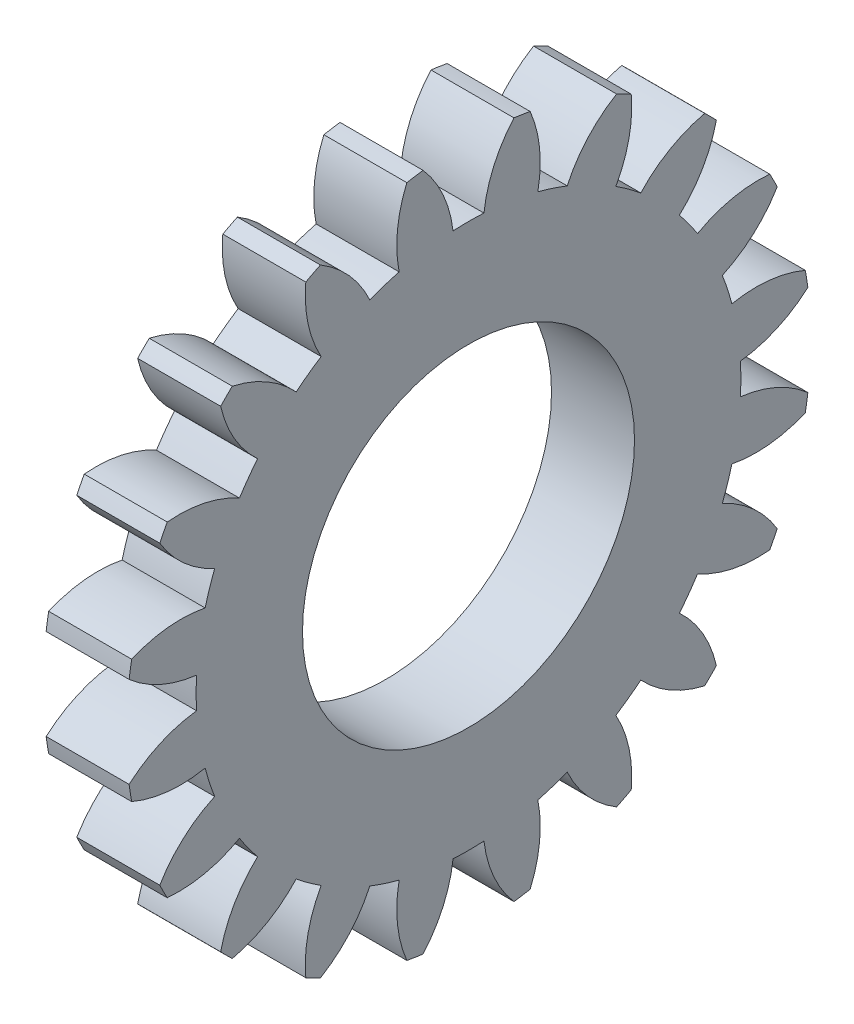
from build123d import *

# Parameters (mm, degrees)
BASPROSKE_W     = 4
BASPROSKE_H     = 16.5
TOOTHCUT_DEPTH  = 24.674881203
TEETHCUTS_COUNT = 20
TEETHCUTS_ANGLE = 342
BORSKE_R        = 8
BORE_DEPTH      = 50.0000508


with BuildPart() as part:
    # BasProSke → Base-Revolve (revolve)
    with BuildSketch(Plane(origin=(0, 0, 0), x_dir=(1, 0, 0), z_dir=(0, 1, 0)), mode=Mode.PRIVATE) as base_revolve_sk:
        with Locations((2, 8.25)):
            Rectangle(BASPROSKE_W, BASPROSKE_H)
    revolve(base_revolve_sk.sketch.rotate(Axis((-10, 0, 0), (1, 0, 0)), 180), axis=Axis((-10, 0, 0), (1, 0, 0)))

    # TooCutSke → ToothCut (cut, through all)
    with BuildSketch(Plane(origin=(0, 0, 0), x_dir=(0, 0, -1), z_dir=(1, 0, 0))):
        with BuildLine():
            ThreePointArc((0.74381438, 13.102904875), (0, 13.124), (-0.74381438, 13.102904875))
            ThreePointArc((-0.74381438, 13.102904875), (-1.226473103, 14.852072512), (-2.209965745, 16.376962373))
            ThreePointArc((-2.209965745, 16.376962373), (0, 16.5254), (2.209965745, 16.376962373))
            ThreePointArc((2.209965745, 16.376962373), (1.226473103, 14.852072512), (0.74381438, 13.102904875))
        make_face()
    toothcut = extrude(amount=TOOTHCUT_DEPTH, mode=Mode.SUBTRACT)

    # TeethCuts: ToothCut ×20 about axis
    teethcuts_axis = Axis((-10, 0, 0), (1, 0, 0))
    for i in range(1, TEETHCUTS_COUNT):
        add(toothcut.rotate(teethcuts_axis, i * TEETHCUTS_ANGLE / (TEETHCUTS_COUNT - 1)), mode=Mode.SUBTRACT)

    # BorSke → Bore (cut, symmetric)
    with BuildSketch(Plane(origin=(0, 0, 0), x_dir=(0, 0, -1), z_dir=(1, 0, 0))):
        with Locations(Location((0, 0, 0), (0, 0, 180))):
            Circle(BORSKE_R)
    extrude(amount=BORE_DEPTH, both=True, mode=Mode.SUBTRACT)


solid = part.part
